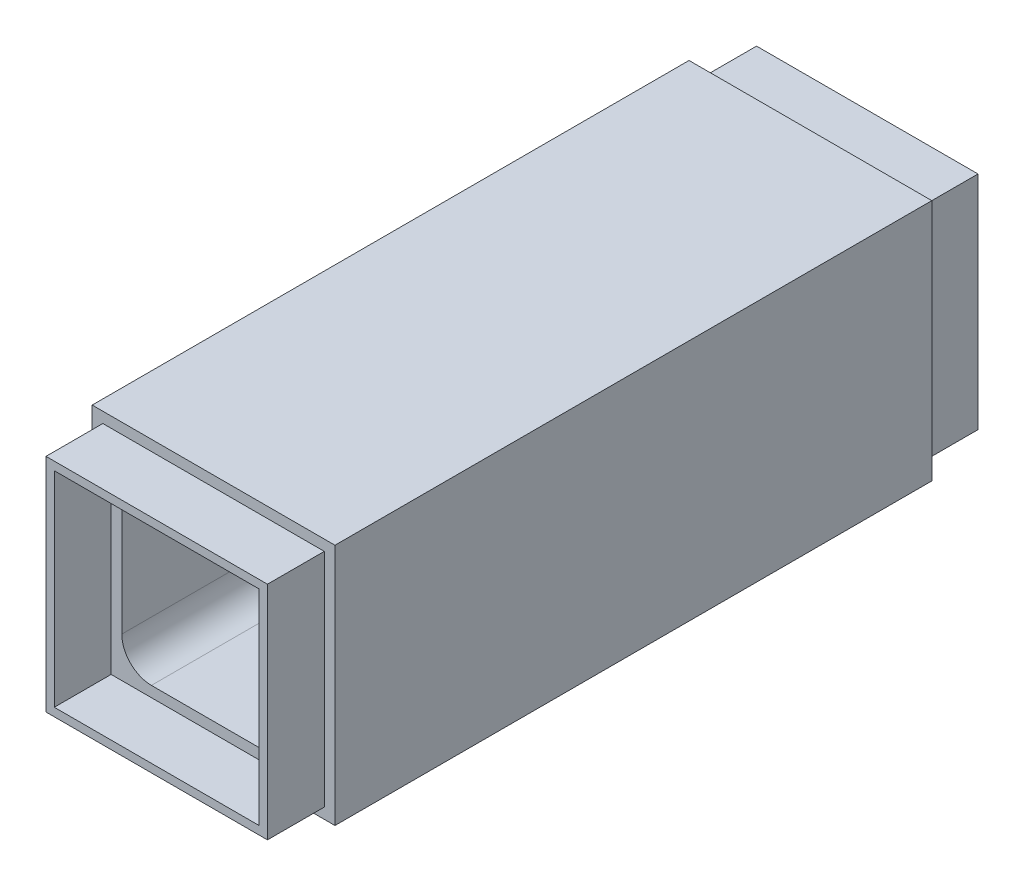
from build123d import *

# Parameters (mm, degrees)
SKETCH1_W           = 52.07
SKETCH1_H           = 52.07
BOSS_EXTRUDE1_DEPTH = 152.4
SKETCH2_W           = 39.37
SKETCH2_H           = 39.37
CUT_EXTRUDE1_DEPTH  = 170.258174987
SKETCH3_W           = 52.07
SKETCH3_H           = 52.07
SKETCH3_W_2         = 47.498
SKETCH3_H_2         = 47.498
SKETCH3_W_3         = 43.942
SKETCH3_H_3         = 43.942
SKETCH3_W_4         = 39.37
SKETCH3_H_4         = 39.37
CUT_EXTRUDE2_DEPTH  = 12.192
FILLET1_R           = 6.35


with BuildPart() as part:
    # Sketch1 → Boss-Extrude1 (new body)
    with BuildSketch(Plane.XY):
        with Locations((26.035, 26.035)):
            Rectangle(SKETCH1_W, SKETCH1_H)
    extrude(amount=-BOSS_EXTRUDE1_DEPTH)

    # Sketch2 → Cut-Extrude1 (cut, through all)
    with BuildSketch(Plane.XY):
        with Locations((26.035, 26.035)):
            Rectangle(SKETCH2_W, SKETCH2_H)
    extrude(amount=-CUT_EXTRUDE1_DEPTH, mode=Mode.SUBTRACT)

    # Sketch3 → Cut-Extrude2 (cut)
    # profile 1 of 2: a face of its own
    with BuildSketch(Plane.XY):
        with Locations((26.035, 26.035)):
            Rectangle(SKETCH3_W, SKETCH3_H)
        with Locations((26.035, 26.035)):
            Rectangle(SKETCH3_W_2, SKETCH3_H_2, mode=Mode.SUBTRACT)
    # profile 2 of 2: a face of its own
    with BuildSketch(Plane.XY):
        with Locations((26.035, 26.035)):
            Rectangle(SKETCH3_W_3, SKETCH3_H_3)
        with Locations((26.035, 26.035)):
            Rectangle(SKETCH3_W_4, SKETCH3_H_4, mode=Mode.SUBTRACT)
    cut_extrude2 = extrude(amount=-CUT_EXTRUDE2_DEPTH, mode=Mode.SUBTRACT)

    # Mirror1: Cut-Extrude2 across plane
    add(cut_extrude2.mirror(Plane(origin=(0, 0, -76.2), x_dir=(1, 0, 0), z_dir=(0, 0, -1))), mode=Mode.SUBTRACT)

    # Fillet1
    fillet1_edges = [part.edges().sort_by_distance(p)[0] for p in [
        (45.72, 6.35, -76.2),
        (6.35, 6.35, -76.2),
        (45.72, 45.72, -76.2),
        (6.35, 45.72, -76.2),
    ]]
    fillet(fillet1_edges, radius=FILLET1_R)


solid = part.part
